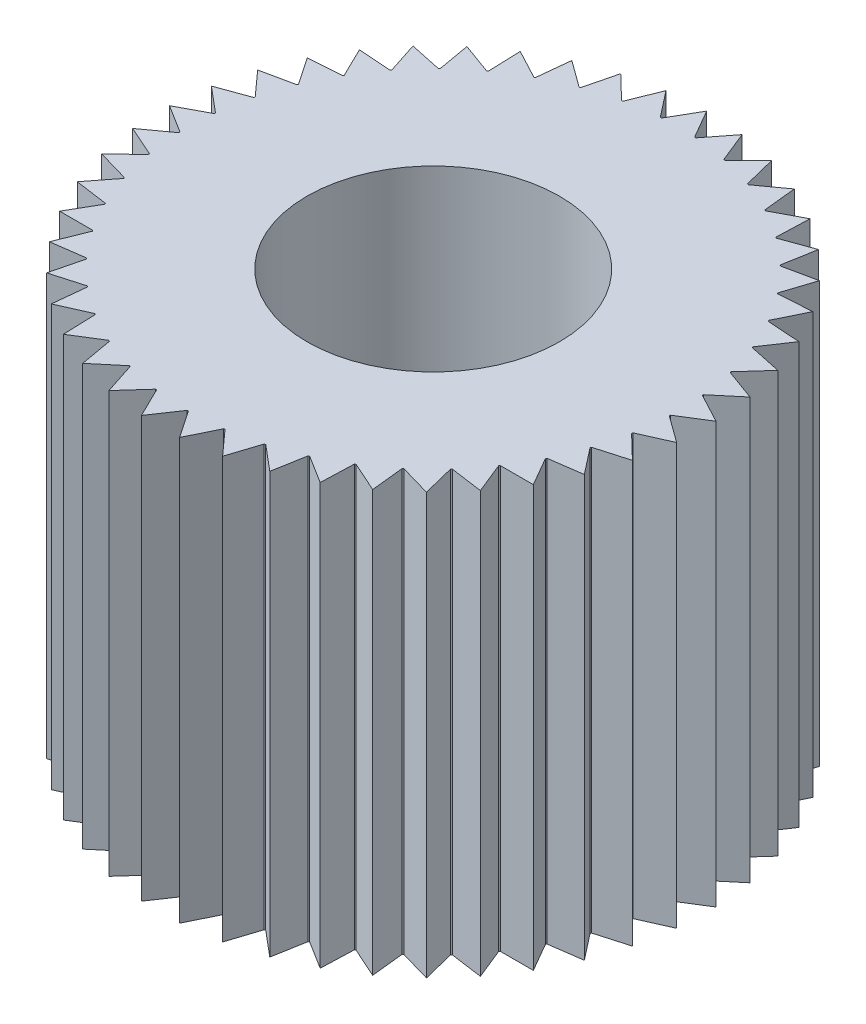
from build123d import *

# Parameters (mm, degrees)
BOSS_EXTRUDE1_DEPTH = 3.81
SKETCH4_R           = 1.143
CUT_EXTRUDE2_DEPTH  = 2.286
SKETCH5_R           = 0.635
CUT_EXTRUDE3_DEPTH  = 1.27


with BuildPart() as part:
    # Sketch2 → Boss-Extrude1 (new body)
    with BuildSketch(Plane(origin=(0, 0, 0), x_dir=(1, 0, 0), z_dir=(0, 1, 0))):
        with BuildLine():
            Line((0.344662185, 2.452398872), (0.160511142, 2.216696286))
            ThreePointArc((0.160511142, 2.216696286), (0.155033763, 2.217086102), (0.149555438, 2.217462383))
            Line((0.149555438, 2.217462383), (0, 2.4765))
            Line((0, 2.4765), (-0.149555438, 2.217462383))
            ThreePointArc((-0.149555438, 2.217462383), (-0.155033763, 2.217086102), (-0.160511142, 2.216696286))
            Line((-0.160511142, 2.216696286), (-0.344662185, 2.452398872))
            Line((-0.344662185, 2.452398872), (-0.456711091, 2.175068098))
            ThreePointArc((-0.456711091, 2.175068098), (-0.462083733, 2.173933043), (-0.467453554, 2.172784717))
            Line((-0.467453554, 2.172784717), (-0.682615912, 2.38056459))
            Line((-0.682615912, 2.38056459), (-0.754977382, 2.090338586))
            ThreePointArc((-0.754977382, 2.090338586), (-0.760139769, 2.08846685), (-0.765297515, 2.086582364))
            Line((-0.765297515, 2.086582364), (-1.007283297, 2.262395326))
            Line((-1.007283297, 2.262395326), (-1.038548897, 1.964923011))
            ThreePointArc((-1.038548897, 1.964923011), (-1.043400548, 1.962351025), (-1.04824583, 1.95976706))
            Line((-1.04824583, 1.95976706), (-1.312345058, 2.10019111))
            Line((-1.312345058, 2.10019111), (-1.301906239, 1.801262445))
            ThreePointArc((-1.301906239, 1.801262445), (-1.306352723, 1.79804027), (-1.310791233, 1.794807119))
            Line((-1.310791233, 1.794807119), (-1.591863515, 1.897109063))
            Line((-1.591863515, 1.897109063), (-1.539923457, 1.602542354))
            ThreePointArc((-1.539923457, 1.602542354), (-1.543878228, 1.598732706), (-1.547823575, 1.594913299))
            Line((-1.547823575, 1.594913299), (-1.84039816, 1.657101947))
            Line((-1.84039816, 1.657101947), (-1.747967817, 1.372630599))
            ThreePointArc((-1.747967817, 1.372630599), (-1.7513539, 1.368307629), (-1.754729292, 1.363976306))
            Line((-1.754729292, 1.363976306), (-2.053111548, 1.384841225))
            Line((-2.053111548, 1.384841225), (-1.921989971, 1.116002151))
            ThreePointArc((-1.921989971, 1.116002151), (-1.92474146, 1.11125), (-1.927481199, 1.106491065))
            Line((-1.927481199, 1.106491065), (-2.225863456, 1.085626145))
            Line((-2.225863456, 1.085626145), (-2.058602777, 0.837651991))
            ThreePointArc((-2.058602777, 0.837651991), (-2.060666117, 0.832563154), (-2.062716877, 0.827469234))
            Line((-2.062716877, 0.827469234), (-2.355291463, 0.765280587))
            Line((-2.355291463, 0.765280587), (-2.155147221, 0.542997887))
            ThreePointArc((-2.155147221, 0.542997887), (-2.156482252, 0.537671413), (-2.157804118, 0.532341657))
            Line((-2.157804118, 0.532341657), (-2.4388764, 0.430039712))
            Line((-2.4388764, 0.430039712), (-2.209744176, 0.237774947))
            ThreePointArc((-2.209744176, 0.237774947), (-2.210324912, 0.23231451), (-2.210892156, 0.226852654))
            Line((-2.210892156, 0.226852654), (-2.474991383, 0.086428604))
            Line((-2.474991383, 0.086428604), (-2.221330975, -0.072076012))
            ThreePointArc((-2.221330975, -0.072076012), (-2.221146113, -0.077564131), (-2.220947692, -0.083051778))
            Line((-2.220947692, -0.083051778), (-2.462933474, -0.258864739))
            Line((-2.462933474, -0.258864739), (-2.189682092, -0.380524093))
            ThreePointArc((-2.189682092, -0.380524093), (-2.188735231, -0.385933075), (-2.187775009, -0.391339701))
            Line((-2.187775009, -0.391339701), (-2.402937366, -0.599119574))
            Line((-2.402937366, -0.599119574), (-2.115413539, -0.681565705))
            ThreePointArc((-2.115413539, -0.681565705), (-2.113723107, -0.68679027), (-2.112019773, -0.692010642))
            Line((-2.112019773, -0.692010642), (-2.296170816, -0.927713229))
            Line((-2.296170816, -0.927713229), (-1.999970867, -0.969341417))
            ThreePointArc((-1.999970867, -0.969341417), (-1.997569768, -0.974279874), (-1.995156475, -0.979212383))
            Line((-1.995156475, -0.979212383), (-2.144711912, -1.23825))
            Line((-2.144711912, -1.23825), (-1.845601037, -1.23825))
            ThreePointArc((-1.845601037, -1.23825), (-1.842536005, -1.242806228), (-1.839459725, -1.247354869))
            Line((-1.839459725, -1.247354869), (-1.951508631, -1.524685644))
            Line((-1.951508631, -1.524685644), (-1.655308682, -1.483057456))
            ThreePointArc((-1.655308682, -1.483057456), (-1.651639375, -1.487142773), (-1.647959984, -1.491219011))
            Line((-1.647959984, -1.491219011), (-1.720321454, -1.781445016))
            Line((-1.720321454, -1.781445016), (-1.432797627, -1.698998885))
            ThreePointArc((-1.432797627, -1.698998885), (-1.428595463, -1.702533775), (-1.424384577, -1.706058272))
            Line((-1.424384577, -1.706058272), (-1.455650177, -2.003530587))
            Line((-1.455650177, -2.003530587), (-1.182398796, -1.881871233))
            ThreePointArc((-1.182398796, -1.881871233), (-1.177745565, -1.884786894), (-1.173085144, -1.887691048))
            Line((-1.173085144, -1.887691048), (-1.162646325, -2.186619714))
            Line((-1.162646325, -2.186619714), (-0.908985917, -2.028115099))
            ThreePointArc((-0.908985917, -2.028115099), (-0.903972189, -2.03035478), (-0.898952943, -2.032582066))
            Line((-0.898952943, -2.032582066), (-0.847012885, -2.327148775))
            Line((-0.847012885, -2.327148775), (-0.617880661, -2.134884011))
            ThreePointArc((-0.617880661, -2.134884011), (-0.612604023, -2.136404119), (-0.607323646, -2.137911186))
            Line((-0.607323646, -2.137911186), (-0.514893302, -2.422382533))
            Line((-0.514893302, -2.422382533), (-0.314749061, -2.200099834))
            ThreePointArc((-0.314749061, -2.200099834), (-0.309312217, -2.200870783), (-0.303873485, -2.201628296))
            Line((-0.303873485, -2.201628296), (-0.172751907, -2.47046737))
            Line((-0.172751907, -2.47046737), (-0.005491228, -2.222493216))
            ThreePointArc((-0.005491228, -2.222493216), (0, -2.2225), (0.005491228, -2.222493216))
            Line((0.005491228, -2.222493216), (0.172751907, -2.47046737))
            Line((0.172751907, -2.47046737), (0.303873485, -2.201628296))
            ThreePointArc((0.303873485, -2.201628296), (0.309312217, -2.200870783), (0.314749061, -2.200099834))
            Line((0.314749061, -2.200099834), (0.514893302, -2.422382533))
            Line((0.514893302, -2.422382533), (0.607323646, -2.137911186))
            ThreePointArc((0.607323646, -2.137911186), (0.612604023, -2.136404119), (0.617880661, -2.134884011))
            Line((0.617880661, -2.134884011), (0.847012885, -2.327148775))
            Line((0.847012885, -2.327148775), (0.898952943, -2.032582066))
            ThreePointArc((0.898952943, -2.032582066), (0.903972189, -2.03035478), (0.908985917, -2.028115099))
            Line((0.908985917, -2.028115099), (1.162646325, -2.186619714))
            Line((1.162646325, -2.186619714), (1.173085144, -1.887691048))
            ThreePointArc((1.173085144, -1.887691048), (1.177745565, -1.884786894), (1.182398796, -1.881871233))
            Line((1.182398796, -1.881871233), (1.455650177, -2.003530587))
            Line((1.455650177, -2.003530587), (1.424384577, -1.706058272))
            ThreePointArc((1.424384577, -1.706058272), (1.428595463, -1.702533775), (1.432797627, -1.698998885))
            Line((1.432797627, -1.698998885), (1.720321454, -1.781445016))
            Line((1.720321454, -1.781445016), (1.647959984, -1.491219011))
            ThreePointArc((1.647959984, -1.491219011), (1.651639375, -1.487142773), (1.655308682, -1.483057456))
            Line((1.655308682, -1.483057456), (1.951508631, -1.524685644))
            Line((1.951508631, -1.524685644), (1.839459725, -1.247354869))
            ThreePointArc((1.839459725, -1.247354869), (1.842536005, -1.242806228), (1.845601037, -1.23825))
            Line((1.845601037, -1.23825), (2.144711912, -1.23825))
            Line((2.144711912, -1.23825), (1.995156475, -0.979212383))
            ThreePointArc((1.995156475, -0.979212383), (1.997569768, -0.974279874), (1.999970867, -0.969341417))
            Line((1.999970867, -0.969341417), (2.296170816, -0.927713229))
            Line((2.296170816, -0.927713229), (2.112019773, -0.692010642))
            ThreePointArc((2.112019773, -0.692010642), (2.113723107, -0.68679027), (2.115413539, -0.681565705))
            Line((2.115413539, -0.681565705), (2.402937366, -0.599119574))
            Line((2.402937366, -0.599119574), (2.187775009, -0.391339701))
            ThreePointArc((2.187775009, -0.391339701), (2.188735231, -0.385933075), (2.189682092, -0.380524093))
            Line((2.189682092, -0.380524093), (2.462933474, -0.258864739))
            Line((2.462933474, -0.258864739), (2.220947692, -0.083051778))
            ThreePointArc((2.220947692, -0.083051778), (2.221146113, -0.077564131), (2.221330975, -0.072076012))
            Line((2.221330975, -0.072076012), (2.474991383, 0.086428604))
            Line((2.474991383, 0.086428604), (2.210892156, 0.226852654))
            ThreePointArc((2.210892156, 0.226852654), (2.210324912, 0.23231451), (2.209744176, 0.237774947))
            Line((2.209744176, 0.237774947), (2.4388764, 0.430039712))
            Line((2.4388764, 0.430039712), (2.157804118, 0.532341657))
            ThreePointArc((2.157804118, 0.532341657), (2.156482252, 0.537671413), (2.155147221, 0.542997887))
            Line((2.155147221, 0.542997887), (2.355291463, 0.765280587))
            Line((2.355291463, 0.765280587), (2.062716877, 0.827469234))
            ThreePointArc((2.062716877, 0.827469234), (2.060666117, 0.832563154), (2.058602777, 0.837651991))
            Line((2.058602777, 0.837651991), (2.225863456, 1.085626145))
            Line((2.225863456, 1.085626145), (1.927481199, 1.106491065))
            ThreePointArc((1.927481199, 1.106491065), (1.92474146, 1.11125), (1.921989971, 1.116002151))
            Line((1.921989971, 1.116002151), (2.053111548, 1.384841225))
            Line((2.053111548, 1.384841225), (1.754729292, 1.363976306))
            ThreePointArc((1.754729292, 1.363976306), (1.7513539, 1.368307629), (1.747967817, 1.372630599))
            Line((1.747967817, 1.372630599), (1.84039816, 1.657101947))
            Line((1.84039816, 1.657101947), (1.547823575, 1.594913299))
            ThreePointArc((1.547823575, 1.594913299), (1.543878228, 1.598732706), (1.539923457, 1.602542354))
            Line((1.539923457, 1.602542354), (1.591863515, 1.897109063))
            Line((1.591863515, 1.897109063), (1.310791233, 1.794807119))
            ThreePointArc((1.310791233, 1.794807119), (1.306352723, 1.79804027), (1.301906239, 1.801262445))
            Line((1.301906239, 1.801262445), (1.312345058, 2.10019111))
            Line((1.312345058, 2.10019111), (1.04824583, 1.95976706))
            ThreePointArc((1.04824583, 1.95976706), (1.043400548, 1.962351025), (1.038548897, 1.964923011))
            Line((1.038548897, 1.964923011), (1.007283297, 2.262395326))
            Line((1.007283297, 2.262395326), (0.765297515, 2.086582364))
            ThreePointArc((0.765297515, 2.086582364), (0.760139769, 2.08846685), (0.754977382, 2.090338586))
            Line((0.754977382, 2.090338586), (0.682615912, 2.38056459))
            Line((0.682615912, 2.38056459), (0.467453554, 2.172784717))
            ThreePointArc((0.467453554, 2.172784717), (0.462083733, 2.173933043), (0.456711091, 2.175068098))
            Line((0.456711091, 2.175068098), (0.344662185, 2.452398872))
        make_face()
    extrude(amount=BOSS_EXTRUDE1_DEPTH)

    # Sketch4 → Cut-Extrude2 (cut)
    with BuildSketch(Plane(origin=(0, 3.81, 0), x_dir=(1, 0, 0), z_dir=(0, 1, 0))):
        with Locations(Location((0, 0, 0), (0, 0, 270))):
            Circle(SKETCH4_R)
    extrude(amount=-CUT_EXTRUDE2_DEPTH, mode=Mode.SUBTRACT)

    # Sketch5 → Cut-Extrude3 (cut)
    with BuildSketch(Plane.XZ):
        with Locations(Location((0, 0, 0), (0, 0, 270))):
            Circle(SKETCH5_R)
    extrude(amount=-CUT_EXTRUDE3_DEPTH, mode=Mode.SUBTRACT)


solid = part.part
